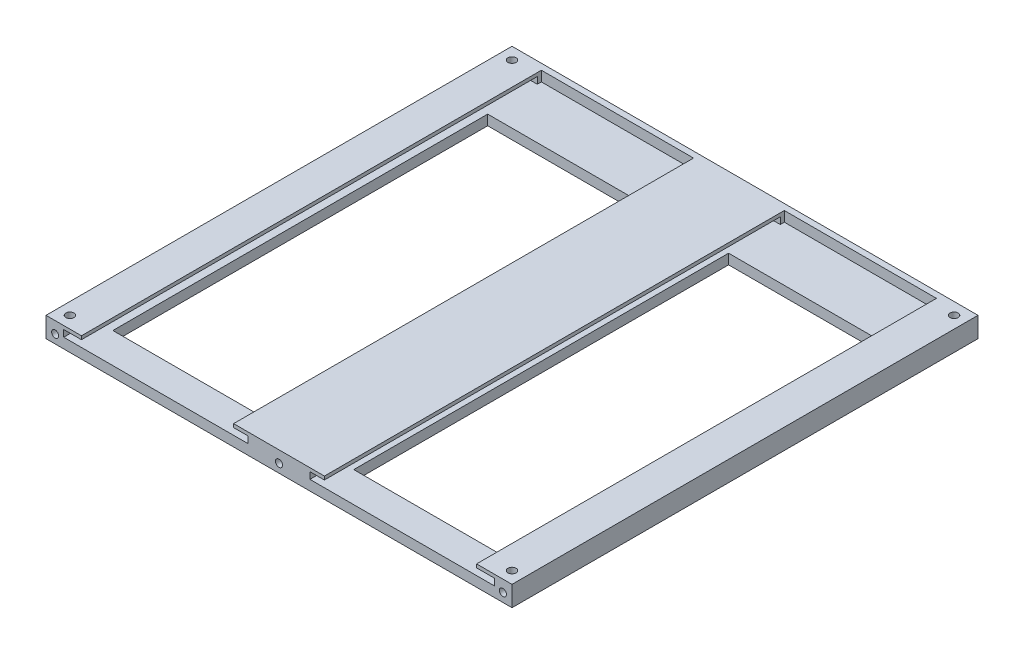
from build123d import *

# Parameters (mm, degrees)
CROQUIS1_W              = 230
CROQUIS1_H              = 230
CROQUIS1_R              = 2
SALIENTE_EXTRUIR1_DEPTH = 5
CROQUIS2_W              = 17.489873555
CROQUIS2_H              = 230
CROQUIS2_W_2            = 44.814479666
SALIENTE_EXTRUIR2_DEPTH = 5
CROQUIS3_W              = 91
CROQUIS3_H              = 3.3
CORTAR_EXTRUIR1_DEPTH   = 225
CROQUIS4_W              = 75.102886612
CROQUIS4_H              = 185
CORTAR_EXTRUIR2_DEPTH   = 256
CROQUIS5_R              = 2.6
CORTAR_EXTRUIR3_DEPTH   = 4
CROQUIS13_R             = 2
CORTAR_EXTRUIR5_DEPTH   = 88
CROQUIS14_R             = 3
CORTAR_EXTRUIR6_DEPTH   = 3
CROQUIS16_R             = 1.75
CORTAR_EXTRUIR7_DEPTH   = 3
CROQUIS18_W             = 230
CROQUIS18_H             = 10
SALIENTE_EXTRUIR4_DEPTH = 3


with BuildPart() as part:
    # Croquis1 → Saliente-Extruir1 (new body)
    with BuildSketch(Plane(origin=(0, 0, 0), x_dir=(1, 0, 0), z_dir=(0, 1, 0))):
        Rectangle(CROQUIS1_W, CROQUIS1_H)
        with Locations(Location((109.100078083, 109.100078083, 0), (0, 0, 270))):
            Circle(CROQUIS1_R, mode=Mode.SUBTRACT)
        with Locations(Location((-109.100078083, 109.100078083, 0), (0, 0, 270))):
            Circle(CROQUIS1_R, mode=Mode.SUBTRACT)
        with Locations(Location((-109.100078083, -109.100078083, 0), (0, 0, 270))):
            Circle(CROQUIS1_R, mode=Mode.SUBTRACT)
        with Locations(Location((109.100078083, -109.100078083, 0), (0, 0, 270))):
            Circle(CROQUIS1_R, mode=Mode.SUBTRACT)
    extrude(amount=SALIENTE_EXTRUIR1_DEPTH)

    # Croquis2 → Saliente-Extruir2 (add)
    with BuildSketch(Plane(origin=(0, 5, 0), x_dir=(1, 0, 0), z_dir=(0, 1, 0))):
        with Locations((-106.255063223, 0)):
            Rectangle(CROQUIS2_W, CROQUIS2_H)
        Rectangle(CROQUIS2_W_2, CROQUIS2_H)
        with Locations((106.255063223, 0)):
            Rectangle(CROQUIS2_W, CROQUIS2_H)
    extrude(amount=SALIENTE_EXTRUIR2_DEPTH)

    # Croquis3 → Cortar-Extruir1 (cut)
    with BuildSketch(Plane.XY.offset(115)):
        with Locations((-60.755063223, 6.65)):
            Rectangle(CROQUIS3_W, CROQUIS3_H)
        with Locations((60.755063223, 6.65)):
            Rectangle(CROQUIS3_W, CROQUIS3_H)
    extrude(amount=-CORTAR_EXTRUIR1_DEPTH, mode=Mode.SUBTRACT)

    # Croquis4 → Cortar-Extruir2 (cut)
    with BuildSketch(Plane(origin=(0, 5, 0), x_dir=(1, 0, 0), z_dir=(0, 1, 0))):
        with Locations((-59.448556694, -7.5)):
            Rectangle(CROQUIS4_W, CROQUIS4_H)
        with Locations((59.448556694, -7.5)):
            Rectangle(CROQUIS4_W, CROQUIS4_H)
    extrude(amount=-CORTAR_EXTRUIR2_DEPTH, mode=Mode.SUBTRACT)

    # Croquis5 → Cortar-Extruir3 (cut)
    with BuildSketch(Plane.XZ):
        with Locations(Location((-82, 105, 0), (0, 0, 270))):
            Circle(CROQUIS5_R)
        with Locations(Location((-36, 105, 0), (0, 0, 270))):
            Circle(CROQUIS5_R)
        with Locations(Location((-13, 105, 0), (0, 0, 270))):
            Circle(CROQUIS5_R)
        with Locations(Location((10, 105, 0), (0, 0, 270))):
            Circle(CROQUIS5_R)
        with Locations(Location((33, 105, 0), (0, 0, 270))):
            Circle(CROQUIS5_R)
        with Locations(Location((79, 105, 0), (0, 0, 270))):
            Circle(CROQUIS5_R)
        with Locations(Location((-13, 82, 0), (0, 0, 270))):
            Circle(CROQUIS5_R)
        with Locations(Location((10, 82, 0), (0, 0, 270))):
            Circle(CROQUIS5_R)
        with Locations(Location((102, 82, 0), (0, 0, 270))):
            Circle(CROQUIS5_R)
        with Locations(Location((-13, 13, 0), (0, 0, 270))):
            Circle(CROQUIS5_R)
        with Locations(Location((10, 13, 0), (0, 0, 270))):
            Circle(CROQUIS5_R)
        with Locations(Location((102, 13, 0), (0, 0, 270))):
            Circle(CROQUIS5_R)
        with Locations(Location((-13, -10, 0), (0, 0, 270))):
            Circle(CROQUIS5_R)
        with Locations(Location((10, -10, 0), (0, 0, 270))):
            Circle(CROQUIS5_R)
        with Locations(Location((102, -10, 0), (0, 0, 270))):
            Circle(CROQUIS5_R)
        with Locations(Location((-13, -79, 0), (0, 0, 270))):
            Circle(CROQUIS5_R)
        with Locations(Location((10, -79, 0), (0, 0, 270))):
            Circle(CROQUIS5_R)
        with Locations(Location((102, -79, 0), (0, 0, 270))):
            Circle(CROQUIS5_R)
        with Locations(Location((-82, -102, 0), (0, 0, 270))):
            Circle(CROQUIS5_R)
        with Locations(Location((-36, -102, 0), (0, 0, 270))):
            Circle(CROQUIS5_R)
        with Locations(Location((-13, -102, 0), (0, 0, 270))):
            Circle(CROQUIS5_R)
        with Locations(Location((10, -102, 0), (0, 0, 270))):
            Circle(CROQUIS5_R)
        with Locations(Location((33, -102, 0), (0, 0, 270))):
            Circle(CROQUIS5_R)
        with Locations(Location((79, -102, 0), (0, 0, 270))):
            Circle(CROQUIS5_R)
        with Locations(Location((-105, 82, 0), (0, 0, 270))):
            Circle(CROQUIS5_R)
        with Locations(Location((-105, 13, 0), (0, 0, 270))):
            Circle(CROQUIS5_R)
        with Locations(Location((-105, -10, 0), (0, 0, 270))):
            Circle(CROQUIS5_R)
        with Locations(Location((-105, -79, 0), (0, 0, 270))):
            Circle(CROQUIS5_R)
    extrude(amount=-CORTAR_EXTRUIR3_DEPTH, mode=Mode.SUBTRACT)

    # Croquis13 → Cortar-Extruir5 (cut)
    with BuildSketch(Plane.XZ.offset(-5)):
        with Locations(Location((-109.100078083, 109.100078083, 0), (0, 0, 90))):
            Circle(CROQUIS13_R)
        with Locations(Location((109.100078083, 109.100078083, 0), (0, 0, 90))):
            Circle(CROQUIS13_R)
        with Locations(Location((109.100078083, -109.100078083, 0), (0, 0, 90))):
            Circle(CROQUIS13_R)
        with Locations(Location((-109.100078083, -109.100078083, 0), (0, 0, 90))):
            Circle(CROQUIS13_R)
    extrude(amount=-CORTAR_EXTRUIR5_DEPTH, mode=Mode.SUBTRACT)

    # Croquis14 → Cortar-Extruir6 (cut)
    with BuildSketch(Plane(origin=(0, 0, 0), x_dir=(-1, 0, 0), z_dir=(0, -1, 0))):
        with Locations(Location((109.100078083, -109.100078083, 0), (0, 0, 90))):
            Circle(CROQUIS14_R)
        with Locations(Location((-109.100078083, -109.100078083, 0), (0, 0, 270))):
            Circle(CROQUIS14_R)
        with Locations(Location((-109.100078083, 109.100078083, 0), (0, 0, 90))):
            Circle(CROQUIS14_R)
        with Locations(Location((109.100078083, 109.100078083, 0), (0, 0, 270))):
            Circle(CROQUIS14_R)
    extrude(amount=-CORTAR_EXTRUIR6_DEPTH, mode=Mode.SUBTRACT)

    # Croquis16 → Cortar-Extruir7 (cut)
    with BuildSketch(Plane.XY.offset(115)):
        with Locations((0, 4.279276807)):
            Circle(CROQUIS16_R)
        with Locations((110.490700251, 4.279276807)):
            Circle(CROQUIS16_R)
        with Locations(Location((-110.490700251, 4.279276807, 0), (0, 0, 313.028420556))):
            Circle(CROQUIS16_R)
    extrude(amount=-CORTAR_EXTRUIR7_DEPTH, mode=Mode.SUBTRACT)

    # Croquis18 → Saliente-Extruir4 (add)
    with BuildSketch(Plane(origin=(0, 0, -115), x_dir=(-1, 0, 0), z_dir=(0, 0, -1))):
        with Locations((0, 5)):
            Rectangle(CROQUIS18_W, CROQUIS18_H)
    extrude(amount=-SALIENTE_EXTRUIR4_DEPTH)


solid = part.part
